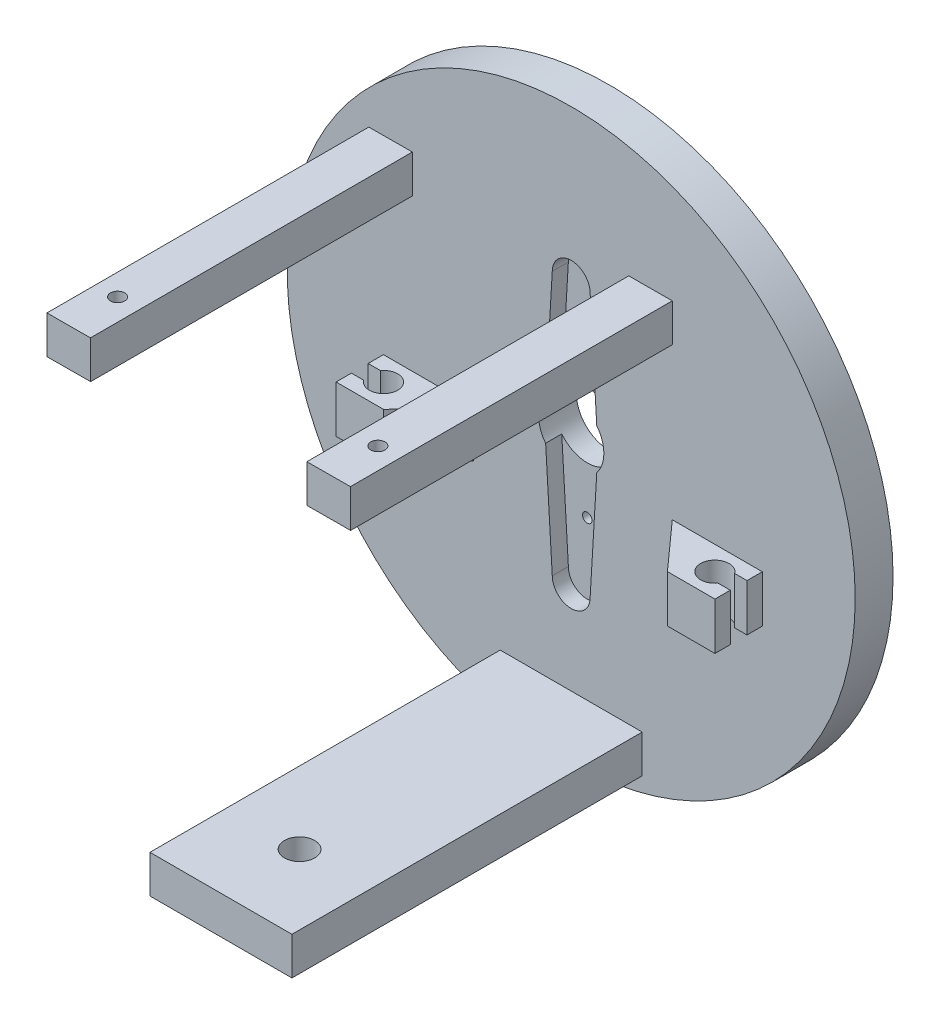
from build123d import *
from build123d.topology import SkipClean

# Parameters (mm, degrees)
SKETCH1_R               = 30
BOSS_EXTRUDE1_DEPTH     = 4
CUT_EXTRUDE1_DEPTH      = 68.201190865
BOSS_EXTRUDE2_START     = -2.3
BOSS_EXTRUDE2_DEPTH     = 2.3
BOSS_EXTRUDE3_DEPTH     = 34
SKETCH5_R               = 0.75
CUT_EXTRUDE2_DEPTH      = 82.573644151
SKETCH6_R               = 0.500000007
SKETCH6_R_2             = 0.5
CUT_EXTRUDE3_DEPTH      = 10
SKETCH7_W               = 15
SKETCH7_H               = 4
BOSS_EXTRUDE4_DEPTH     = 37
SKETCH8_R               = 1.6
CUT_EXTRUDE4_DEPTH      = 37
SKETCH9_W               = 5.021529313
SKETCH9_H               = 4.978377583
SKETCH9_H_2             = 4.978377584
BOSS_EXTRUDE5_DEPTH     = 5
CUT_EXTRUDE5_DEPTH      = 5
CUT_EXTRUDE5_DEPTH_BACK = 15
BOSS_EXTRUDE6_DEPTH     = 4.978377584
BOSS_EXTRUDE7_DEPTH     = 4.978377584


with BuildPart() as part:
    # Sketch1 → Boss-Extrude1 (new body)
    with BuildSketch(Plane.XY):
        with Locations((-30.000000447, 0)):
            Circle(SKETCH1_R)
    extrude(amount=-BOSS_EXTRUDE1_DEPTH)

    # Sketch2 → Cut-Extrude1 (cut, through all)
    with BuildSketch(Plane.XY):
        with BuildLine():
            Line((-32.000000447, 13.925), (-32.700000447, 2.147673159))
            ThreePointArc((-32.700000447, 2.147673159), (-33.450000447, 0), (-32.700000447, -2.147673159))
            Line((-32.700000447, -2.147673159), (-32.000000447, -13.925))
            ThreePointArc((-32.000000447, -13.925), (-30.000000447, -15.925), (-28.000000447, -13.925))
            Line((-28.000000447, -13.925), (-27.300000447, -2.147673159))
            ThreePointArc((-27.300000447, -2.147673159), (-26.550000447, 0), (-27.300000447, 2.147673159))
            Line((-27.300000447, 2.147673159), (-28.000000447, 13.925))
            ThreePointArc((-28.000000447, 13.925), (-30.000000447, 15.925), (-32.000000447, 13.925))
        make_face()
    extrude(amount=-CUT_EXTRUDE1_DEPTH, mode=Mode.SUBTRACT)

    # Sketch3 → Boss-Extrude2 (add)
    with SkipClean():  # the faces are left unmerged after this step: merging them gives an invalid solid
        with BuildSketch(Plane(origin=(0, 0, -4), x_dir=(-1, 0, 0), z_dir=(0, 0, -1)).offset(BOSS_EXTRUDE2_START)):
            with BuildLine():
                Line((27.300000447, -2.147673159), (28.000000447, -13.925))
                ThreePointArc((28.000000447, -13.925), (30.000000447, -15.925), (32.000000447, -13.925))
                Line((32.000000447, -13.925), (32.700000447, -2.147673159))
                ThreePointArc((32.700000447, -2.147673159), (30.000000447, -3.45), (27.300000447, -2.147673159))
            make_face()
            with BuildLine():
                Line((32.000000447, 13.925), (32.700000447, 2.147673159))
                ThreePointArc((32.700000447, 2.147673159), (30.000000447, 3.45), (27.300000447, 2.147673159))
                Line((27.300000447, 2.147673159), (28.000000447, 13.925))
                ThreePointArc((28.000000447, 13.925), (30.000000447, 15.925), (32.000000447, 13.925))
            make_face()
        extrude(amount=BOSS_EXTRUDE2_DEPTH)

    # Sketch4 → Boss-Extrude3 (add)
    with SkipClean():  # the faces are left unmerged after this step: merging them gives an invalid solid
        with BuildSketch(Plane.XY):
            Polygon((-23.904804701, 13.547119626), (-19.304847529, 13.566969421), (-19.32210822, 17.566932179), (-23.922065393, 17.547082384), align=None)
            Polygon((-51.364549038, 13.42862498), (-46.764591865, 13.448474775), (-46.781852557, 17.448437533), (-51.381809729, 17.428587738), align=None)
        extrude(amount=BOSS_EXTRUDE3_DEPTH)

    # Sketch5 → Cut-Extrude2 (cut, through all)
    with SkipClean():  # the faces are left unmerged after this step: merging them gives an invalid solid
        with BuildSketch(Plane(origin=(-0.058902743, 13.650019772, 0), x_dir=(0.999990689598316, 0.004315172845242606, 0), z_dir=(0.004315172845242606, -0.9999906895983162, 0))):
            with Locations((-49.026123975, 28.818298908)):
                Circle(SKETCH5_R)
            with Locations((-21.526123975, 28.818298908)):
                Circle(SKETCH5_R)
        extrude(amount=-CUT_EXTRUDE2_DEPTH, mode=Mode.SUBTRACT)

    # Sketch6 → Cut-Extrude3 (cut)
    with SkipClean():  # the faces are left unmerged after this step: merging them gives an invalid solid
        with BuildSketch(Plane.XY):
            with Locations((-30.004011834, -8.464999042)):
                Circle(SKETCH6_R)
            with Locations((-29.99598906, 8.464999042)):
                Circle(SKETCH6_R_2)
        extrude(amount=-CUT_EXTRUDE3_DEPTH, mode=Mode.SUBTRACT)

    # Sketch7 → Boss-Extrude4 (add)
    with SkipClean():  # the faces are left unmerged after this step: merging them gives an invalid solid
        with BuildSketch(Plane.XY):
            with Locations((-30.000000447, -25.474087185)):
                Rectangle(SKETCH7_W, SKETCH7_H)
        extrude(amount=BOSS_EXTRUDE4_DEPTH)

    # Sketch8 → Cut-Extrude4 (cut)
    with SkipClean():  # the faces are left unmerged after this step: merging them gives an invalid solid
        with BuildSketch(Plane.XZ.offset(27.474087185)):
            with Locations((-29.878857802, 28.818298907)):
                Circle(SKETCH8_R)
        extrude(amount=-CUT_EXTRUDE4_DEPTH, mode=Mode.SUBTRACT)

    # Sketch9 → Boss-Extrude5 (add)
    with SkipClean():  # the faces are left unmerged after this step: merging them gives an invalid solid
        with BuildSketch(Plane.XY):
            with Locations((-12.324865315, -4.953083179)):
                Rectangle(SKETCH9_W, SKETCH9_H)
            with Locations((-47.324539451, -5.104114228)):
                Rectangle(SKETCH9_W, SKETCH9_H_2)
        extrude(amount=BOSS_EXTRUDE5_DEPTH)

    # Sketch11 → Cut-Extrude5 (cut, two sides: drawn at the far end of the back side and taken through both)
    with SkipClean():  # the faces are left unmerged after this step: merging them gives an invalid solid
        with BuildSketch(Plane.XZ.offset(7.44227197).offset(-CUT_EXTRUDE5_DEPTH_BACK)):
            with BuildLine():
                Line((-9.814100658, 1.616316037), (-11.112799865, 1.616316037))
                ThreePointArc((-11.112799865, 1.616316037), (-13.824865315, 2.5), (-11.112799865, 3.383683963))
                Line((-11.112799865, 3.383683963), (-9.814100658, 3.383683963))
                Line((-9.814100658, 3.383683963), (-9.814100658, 1.616316037))
            make_face()
            with BuildLine():
                Line((-49.835304107, 3.383683963), (-48.5366049, 3.383683963))
                ThreePointArc((-48.5366049, 3.383683963), (-45.82453945, 2.5), (-48.5366049, 1.616316037))
                Line((-48.5366049, 1.616316037), (-49.835304107, 1.616316037))
                Line((-49.835304107, 1.616316037), (-49.835304107, 3.383683963))
            make_face()
        extrude(amount=CUT_EXTRUDE5_DEPTH + CUT_EXTRUDE5_DEPTH_BACK, mode=Mode.SUBTRACT)

    # Sketch12 → Boss-Extrude6 (add)
    with SkipClean():  # the faces are left unmerged after this step: merging them gives an invalid solid
        with BuildSketch(Plane(origin=(0, -2.463894387, 0), x_dir=(1, 0, 0), z_dir=(0, 1, 0))):
            Polygon((-14.835629971, -5), (-19.32210822, 0), (-14.835629971, 0), align=None)
        extrude(amount=-BOSS_EXTRUDE6_DEPTH)

    # Sketch13 → Boss-Extrude7 (add)
    with SkipClean():  # the faces are left unmerged after this step: merging them gives an invalid solid
        with BuildSketch(Plane(origin=(0, -2.614925436, 0), x_dir=(1, 0, 0), z_dir=(0, 1, 0))):
            Polygon((-44.813774794, -5), (-44.813774794, 0), (-40.313774794, 0), align=None)
        extrude(amount=-BOSS_EXTRUDE7_DEPTH)


solid = part.part
